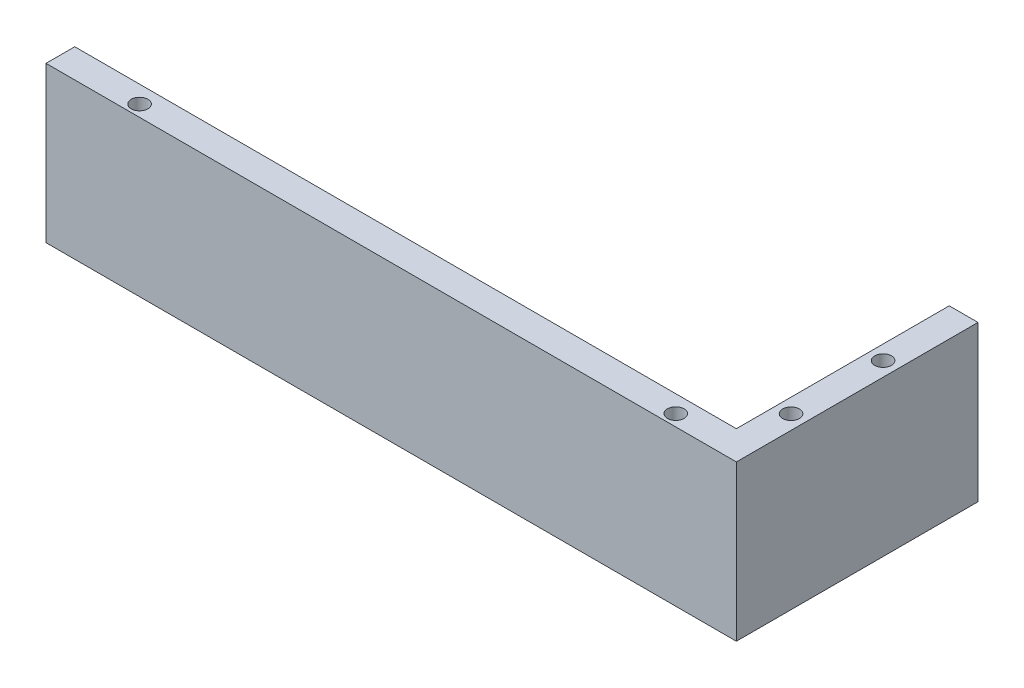
from build123d import *

# Parameters (mm, degrees)
SKETCH_1_W      = 5
SKETCH_1_H      = 40
SKETCH_1_R      = 1.45
EXTRUDE_1_DEPTH = 27
SKETCH_2_W      = 120
SKETCH_2_H      = 5
SKETCH_2_R      = 1.45
EXTRUDE_2_DEPTH = 27


with BuildPart() as part:
    # 草图1 → 凸台-拉伸1 (new body)
    with BuildSketch(Plane(origin=(0, 0, 0), x_dir=(1, 0, 0), z_dir=(0, 1, 0))):
        Rectangle(SKETCH_1_W, SKETCH_1_H)
        with Locations(Location((0, 6, 0), (0, 0, 270))):
            Circle(SKETCH_1_R, mode=Mode.SUBTRACT)
        with Locations(Location((0, -10, 0), (0, 0, 270))):
            Circle(SKETCH_1_R, mode=Mode.SUBTRACT)
    extrude(amount=EXTRUDE_1_DEPTH)

    # 草图2 → 凸台-拉伸2 (add)
    with BuildSketch(Plane(origin=(0, 0, 0), x_dir=(1, 0, 0), z_dir=(0, 1, 0))):
        with Locations((-57.5, -19.5)):
            Rectangle(SKETCH_2_W, SKETCH_2_H)
        with Locations(Location((-10.04, -20, 0), (0, 0, 270))):
            Circle(SKETCH_2_R, mode=Mode.SUBTRACT)
        with Locations(Location((-103.24, -20, 0), (0, 0, 270))):
            Circle(SKETCH_2_R, mode=Mode.SUBTRACT)
    extrude(amount=EXTRUDE_2_DEPTH)


solid = part.part
